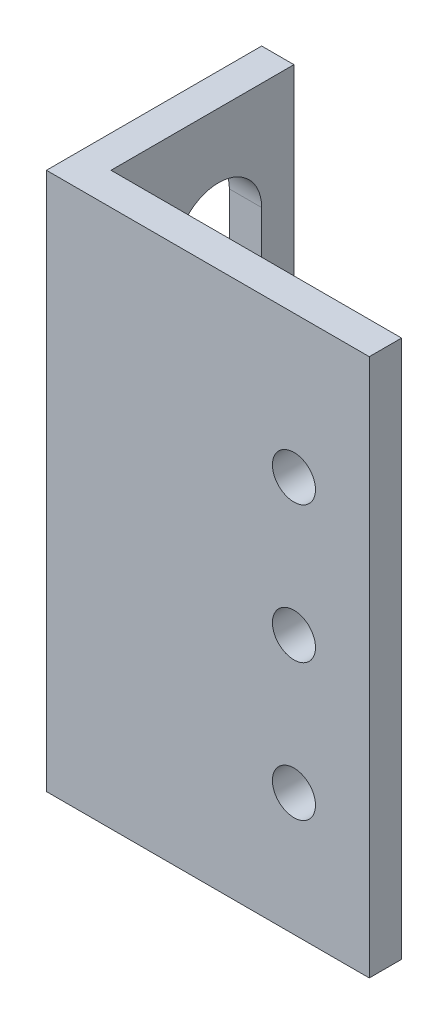
from build123d import *

# Parameters (mm, degrees)
SKETCH_1_W          = 3
SKETCH_1_H          = 17
SKETCH_1_H_2        = 3
SKETCH_1_W_2        = 27
EXTRUDE_1_DEPTH     = 50
SKETCH_2_R          = 2
CUT_EXTRUDE_1_DEPTH = 10
CUT_EXTRUDE_2_DEPTH = 10


with BuildPart() as part:
    # 草图1 → 凸台-拉伸1 (new body)
    with BuildSketch(Plane(origin=(0, 0, 0), x_dir=(1, 0, 0), z_dir=(0, 1, 0))):
        with Locations((0, 1.5)):
            Rectangle(SKETCH_1_W, SKETCH_1_H)
        with Locations((0, -8.5)):
            Rectangle(SKETCH_1_W, SKETCH_1_H_2)
        with Locations((15, -8.5)):
            Rectangle(SKETCH_1_W_2, SKETCH_1_H_2)
    extrude(amount=EXTRUDE_1_DEPTH)

    # 草图2 → 切除-拉伸1 (cut)
    with BuildSketch(Plane.XY.offset(10)):
        with Locations((21.5, 36.8)):
            Circle(SKETCH_2_R)
        with Locations((21.5, 24.1)):
            Circle(SKETCH_2_R)
        with Locations((21.5, 11.4)):
            Circle(SKETCH_2_R)
    extrude(amount=-CUT_EXTRUDE_1_DEPTH, mode=Mode.SUBTRACT)

    # 草图3 → 切除-拉伸2 (cut)
    with BuildSketch(Plane.ZY.offset(1.5)):
        with BuildLine():
            Line((1, 40), (1, 10))
            ThreePointArc((1, 10), (-3, 6), (-7, 10))
            Line((-7, 10), (-7, 40))
            ThreePointArc((-7, 40), (-3, 44), (1, 40))
        make_face()
    extrude(amount=-CUT_EXTRUDE_2_DEPTH, mode=Mode.SUBTRACT)


solid = part.part
